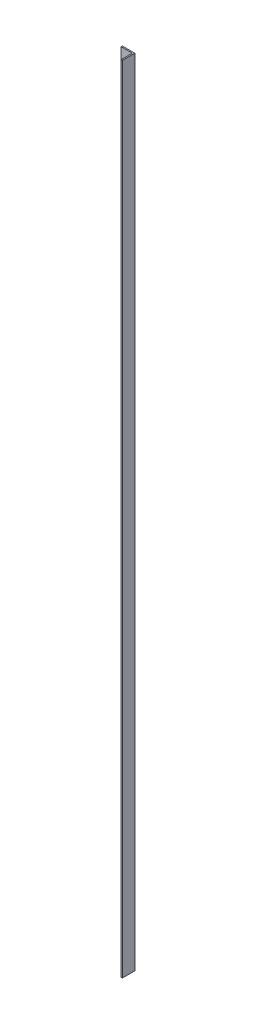
from build123d import *

# Parameters (mm, degrees)
SKETCH_1_W      = 45
SKETCH_1_H      = 3200
EXTRUDE_1_DEPTH = 5
EXTRUDE_3_DEPTH = 3200


with BuildPart() as part:
    # Эскиз1 → Бобышка-Вытянуть1 (new body)
    with BuildSketch(Plane.XY):
        with Locations((-470, 1293.75)):
            Rectangle(SKETCH_1_W, SKETCH_1_H)
    extrude(amount=EXTRUDE_1_DEPTH)

    # Эскиз3 → Бобышка-Вытянуть3 (add)
    with BuildSketch(Plane(origin=(0, 2893.75, 0), x_dir=(1, 0, 0), z_dir=(0, 1, 0))):
        Polygon((-447.5, 0), (-442.5, 0), (-442.5, -5), (-442.5, -50), (-447.5, -50), align=None)
    extrude(amount=-EXTRUDE_3_DEPTH)


solid = part.part
